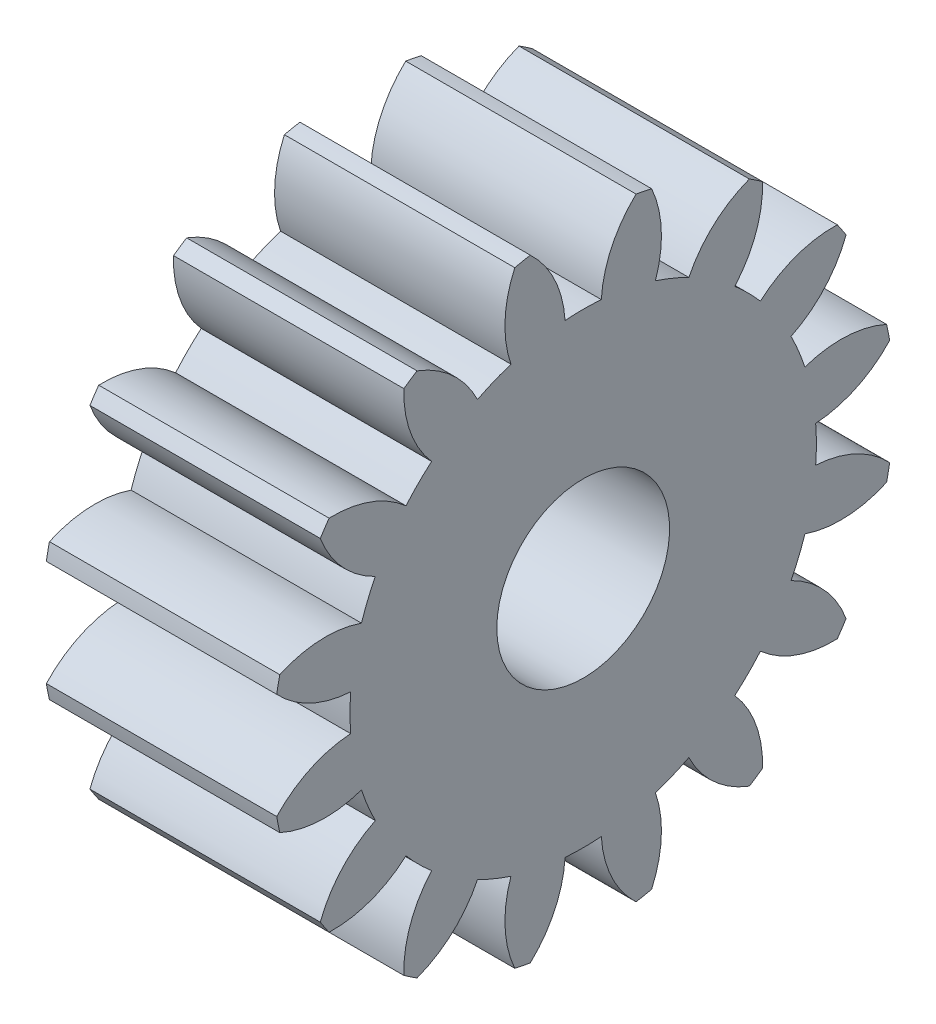
from build123d import *

# Parameters (mm, degrees)
BASPROSKE_W     = 4
BASPROSKE_H     = 5.4
TOOTHCUT_DEPTH  = 9.620904825
TEETHCUTS_COUNT = 16
TEETHCUTS_ANGLE = 337.5
BORSKE_R        = 1.5
BORE_DEPTH      = 50.0000508


with BuildPart() as part:
    # BasProSke → Base-Revolve (revolve)
    with BuildSketch(Plane(origin=(0, 0, 0), x_dir=(1, 0, 0), z_dir=(0, 1, 0)), mode=Mode.PRIVATE) as base_revolve_sk:
        with Locations((2, 2.7)):
            Rectangle(BASPROSKE_W, BASPROSKE_H)
    revolve(base_revolve_sk.sketch.rotate(Axis((-10, 0, 0), (1, 0, 0)), 180), axis=Axis((-10, 0, 0), (1, 0, 0)))

    # TooCutSke → ToothCut (cut, through all)
    with BuildSketch(Plane(origin=(0, 0, 0), x_dir=(0, 0, -1), z_dir=(1, 0, 0))):
        with BuildLine():
            ThreePointArc((0.314546988, 4.036763703), (0, 4.049), (-0.314546988, 4.036763703))
            ThreePointArc((-0.314546988, 4.036763703), (-0.50025311, 4.751345703), (-0.941887923, 5.343015282))
            ThreePointArc((-0.941887923, 5.343015282), (0, 5.4254), (0.941887923, 5.343015282))
            ThreePointArc((0.941887923, 5.343015282), (0.50025311, 4.751345703), (0.314546988, 4.036763703))
        make_face()
    toothcut = extrude(amount=TOOTHCUT_DEPTH, mode=Mode.SUBTRACT)

    # TeethCuts: ToothCut ×16 about axis
    teethcuts_axis = Axis((-10, 0, 0), (1, 0, 0))
    for i in range(1, TEETHCUTS_COUNT):
        add(toothcut.rotate(teethcuts_axis, i * TEETHCUTS_ANGLE / (TEETHCUTS_COUNT - 1)), mode=Mode.SUBTRACT)

    # BorSke → Bore (cut, symmetric)
    with BuildSketch(Plane(origin=(0, 0, 0), x_dir=(0, 0, -1), z_dir=(1, 0, 0))):
        with Locations(Location((0, 0, 0), (0, 0, 180))):
            Circle(BORSKE_R)
    extrude(amount=BORE_DEPTH, both=True, mode=Mode.SUBTRACT)


solid = part.part
